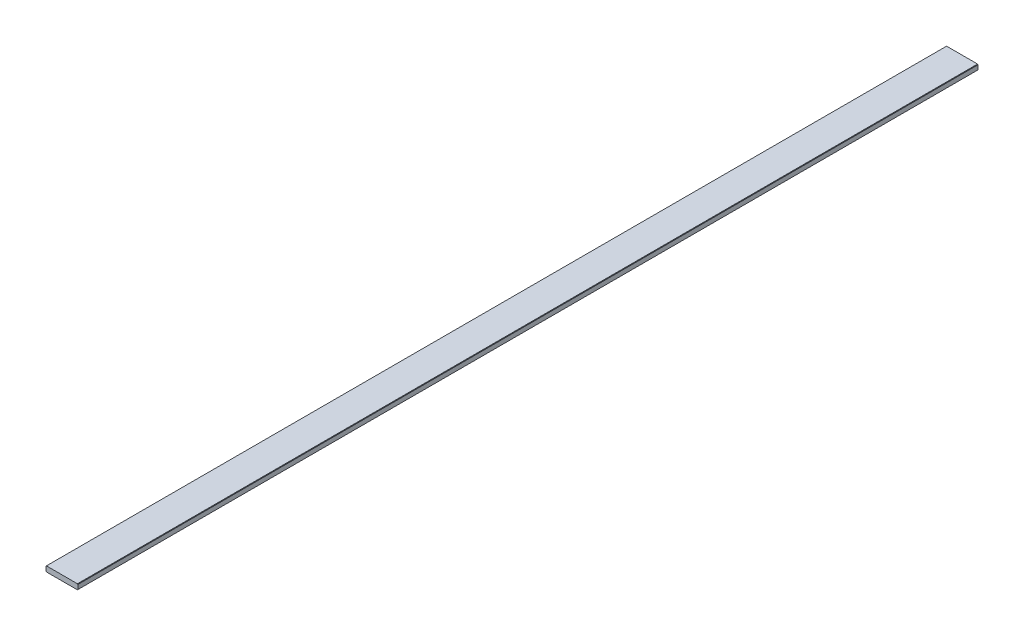
from build123d import *

# Parameters (mm, degrees)
EXTRUDE_1_DEPTH = 4240


with BuildPart() as part:
    # Эскиз1 → Бобышка-Вытянуть1 (new body)
    with BuildSketch(Plane.XY):
        Polygon((-75, 10.5), (-73, 12.5), (73, 12.5), (75, 10.5), (75, -10.5), (73, -12.5), (-73, -12.5), (-75, -10.5), align=None)
    extrude(amount=EXTRUDE_1_DEPTH)


solid = part.part
